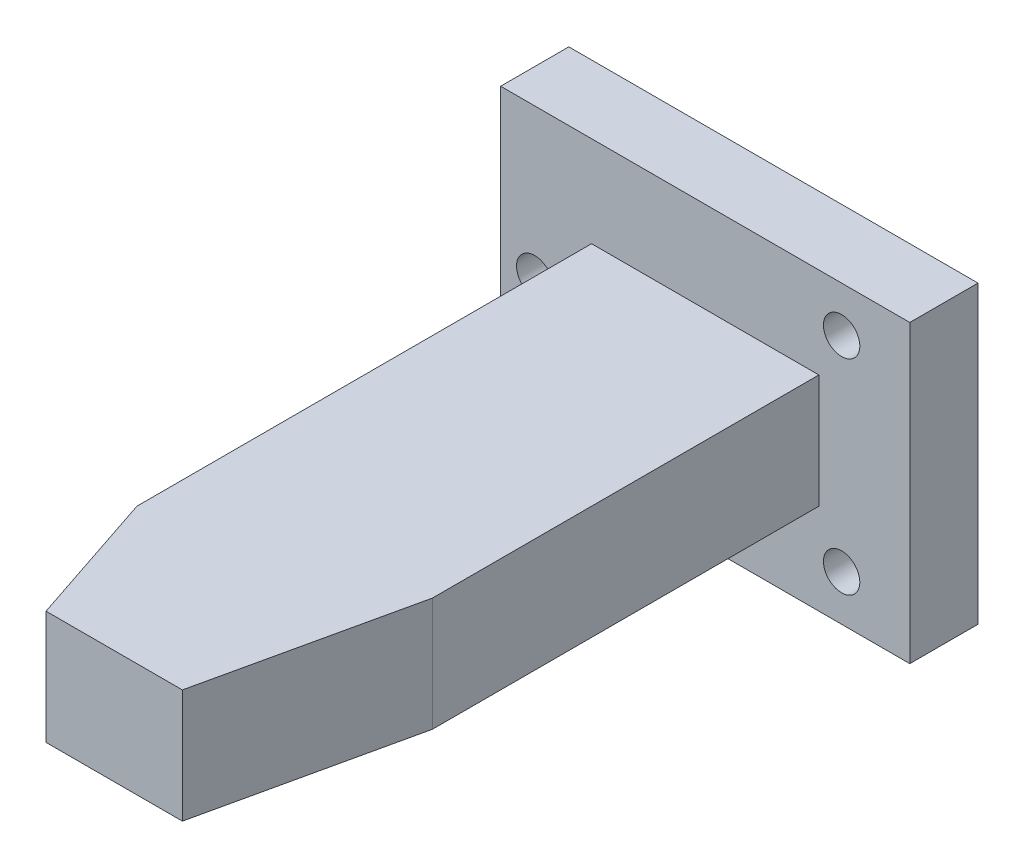
from build123d import *

# Parameters (mm, degrees)
SKETCH_1_W          = 36
SKETCH_1_H          = 26
EXTRUDE_1_DEPTH     = 6
EXTRUDE_START       = -5
EXTRUDE_2_DEPTH     = 10
SKETCH_3_R          = 1.6
CUT_EXTRUDE_2_DEPTH = 70.491006612
SKETCH_4_R          = 3
CUT_EXTRUDE_3_DEPTH = 70.491006612


with BuildPart() as part:
    # 草图1 → 凸台-拉伸1 (new body)
    with BuildSketch(Plane.XY):
        with Locations((18, 0)):
            Rectangle(SKETCH_1_W, SKETCH_1_H)
    extrude(amount=EXTRUDE_1_DEPTH)

    # 草图2 → 凸台-拉伸2 (add)
    with BuildSketch(Plane(origin=(0, 0, 0), x_dir=(1, 0, 0), z_dir=(0, 1, 0)).offset(EXTRUDE_START)):
        Polygon((8, -6), (28, -6), (28, -40), (24, -58), (12, -58), (8, -46), align=None)
    extrude(amount=EXTRUDE_2_DEPTH)

    # 草图3 → 切除-拉伸2 (cut, through all)
    with BuildSketch(Plane.XY):
        with Locations(Location((8, 0, 0), (0, 0, 90))):
            Circle(SKETCH_3_R)
        with Locations(Location((30, -9, 0), (0, 0, 180))):
            Circle(SKETCH_3_R)
        with Locations(Location((30, 9, 0), (0, 0, 180))):
            Circle(SKETCH_3_R)
        with Locations(Location((3, 0, 0), (0, 0, 180))):
            Circle(SKETCH_3_R)
    extrude(amount=CUT_EXTRUDE_2_DEPTH, mode=Mode.SUBTRACT)

    # 草图4 → 切除-拉伸3 (cut, through all)
    with BuildSketch(Plane(origin=(0, 0, 0), x_dir=(1, 0, 0), z_dir=(0, 1, 0))):
        with Locations(Location((18, -54, 0), (0, 0, 270))):
            Circle(SKETCH_4_R)
        with Locations(Location((18, -18, 0), (0, 0, 270))):
            Circle(SKETCH_4_R)
        with Locations(Location((18, -36, 0), (0, 0, 270))):
            Circle(SKETCH_4_R)
    extrude(amount=-CUT_EXTRUDE_3_DEPTH, mode=Mode.SUBTRACT)


solid = part.part
